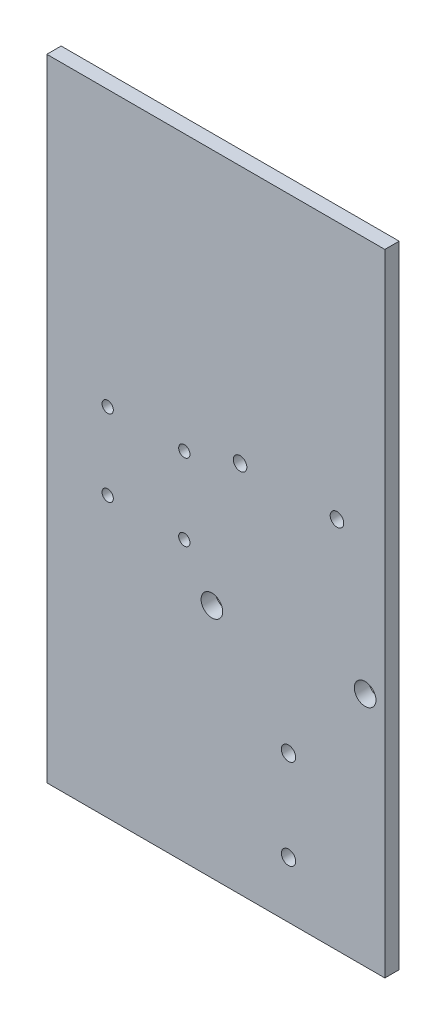
from build123d import *

# Parameters (mm, degrees)
SKETCH1_W           = 150
SKETCH1_H           = 280
BOSS_EXTRUDE1_DEPTH = 6.35
SKETCH4_R           = 3.175
SKETCH4_R_2         = 3
CUT_EXTRUDE1_DEPTH  = 6.35
CUT_EXTRUDE2_DEPTH  = 6.35


with BuildPart() as part:
    # Sketch1 → Boss-Extrude1 (new body)
    with BuildSketch(Plane.XY):
        with Locations((75, 140)):
            Rectangle(SKETCH1_W, SKETCH1_H)
    extrude(amount=BOSS_EXTRUDE1_DEPTH)

    # Sketch4 → Cut-Extrude1 (cut)
    with BuildSketch(Plane.XY):
        with Locations(Location((107.25, 25, 0), (0, 0, 180))):
            Circle(SKETCH4_R)
        with BuildLine():
            ThreePointArc((141.25, 109.597983852), (136.45, 104.797983852), (141.25, 99.997983852))
            ThreePointArc((141.25, 99.997983852), (146.05, 104.797983852), (141.25, 109.597983852))
        make_face()
        with BuildLine():
            ThreePointArc((73.25, 99.997983852), (78.05, 104.797983852), (73.25, 109.597983852))
            ThreePointArc((73.25, 109.597983852), (68.45, 104.797983852), (73.25, 99.997983852))
        make_face()
        with Locations(Location((128.750000003, 165.627983852, 0), (0, 0, 180))):
            Circle(SKETCH4_R_2)
        with Locations(Location((85.750000003, 165.627983852, 0), (0, 0, 180))):
            Circle(SKETCH4_R_2)
        with Locations(Location((107.25, 65, 0), (0, 0, 180))):
            Circle(SKETCH4_R)
    extrude(amount=CUT_EXTRUDE1_DEPTH, mode=Mode.SUBTRACT)

    # Sketch5 → Cut-Extrude2 (cut)
    with BuildSketch(Plane(origin=(0, 0, 6.35), x_dir=(-1, 0, 0), z_dir=(0, 0, 1))):
        with BuildLine():
            ThreePointArc((-61, -155.5), (-63.5, -158), (-61, -160.5))
            ThreePointArc((-61, -160.5), (-58.5, -158), (-61, -155.5))
        make_face()
        with BuildLine():
            ThreePointArc((-27, -155.5), (-29.5, -158), (-27, -160.5))
            ThreePointArc((-27, -160.5), (-24.5, -158), (-27, -155.5))
        make_face()
        with BuildLine():
            ThreePointArc((-27, -121.5), (-29.5, -124), (-27, -126.5))
            ThreePointArc((-27, -126.5), (-24.5, -124), (-27, -121.5))
        make_face()
        with BuildLine():
            ThreePointArc((-61, -126.5), (-58.5, -124), (-61, -121.5))
            ThreePointArc((-61, -121.5), (-63.5, -124), (-61, -126.5))
        make_face()
    extrude(amount=-CUT_EXTRUDE2_DEPTH, mode=Mode.SUBTRACT)


solid = part.part
